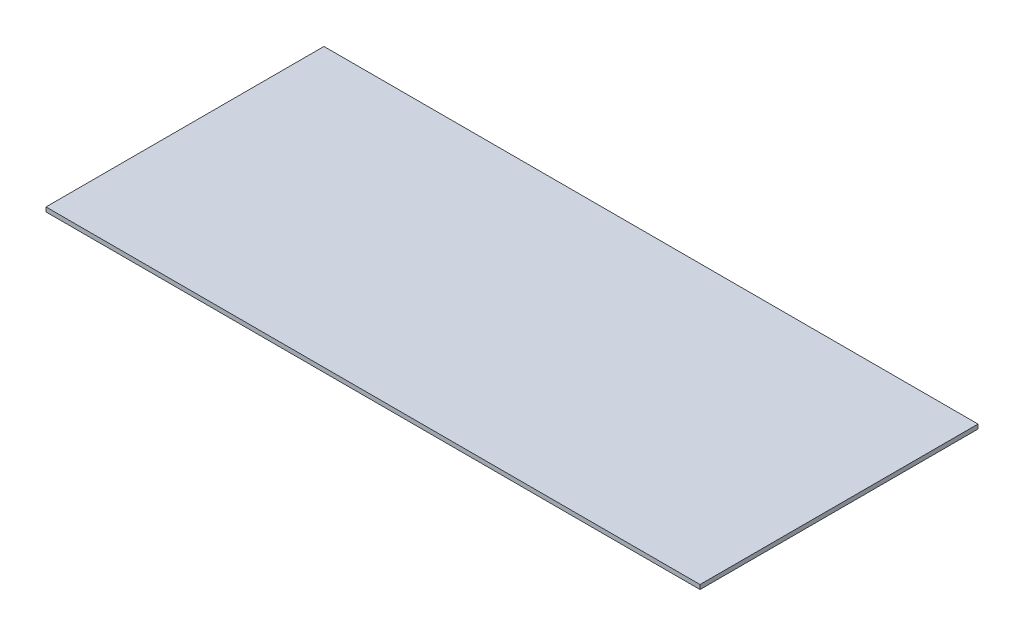
from build123d import *

# Parameters (mm, degrees)
SKETCH1_W           = 190.5
SKETCH1_H           = 80.9625
BOSS_EXTRUDE1_DEPTH = 1.27


with BuildPart() as part:
    # Sketch1 → Boss-Extrude1 (new body)
    with BuildSketch(Plane(origin=(0, 0, 0), x_dir=(1, 0, 0), z_dir=(0, 1, 0))):
        with Locations((95.25, 40.48125)):
            Rectangle(SKETCH1_W, SKETCH1_H)
    extrude(amount=BOSS_EXTRUDE1_DEPTH)


solid = part.part
